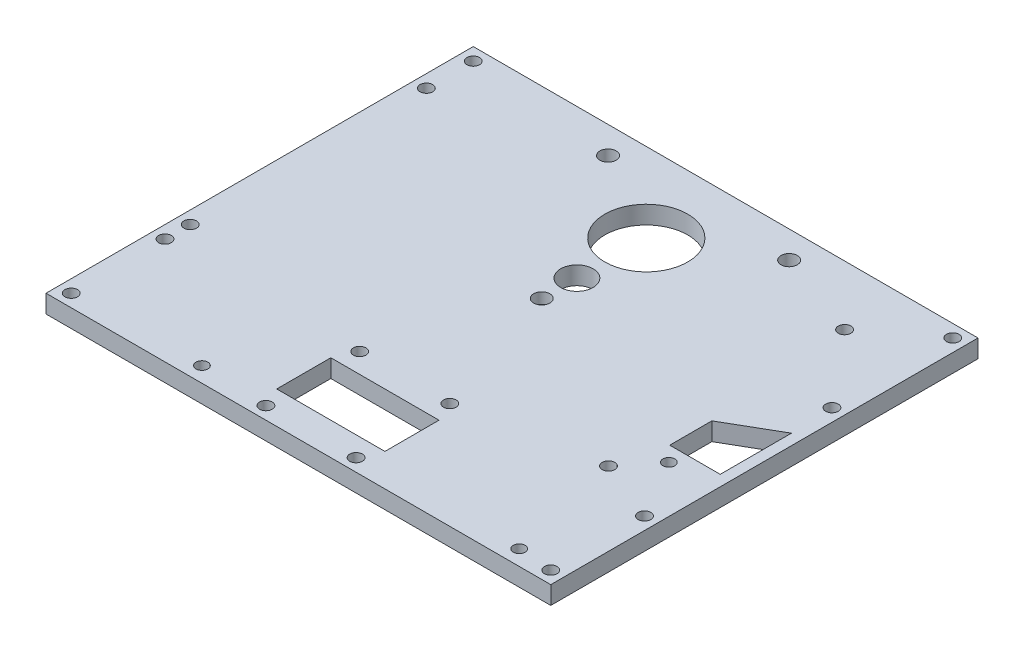
from build123d import *

# Parameters (mm, degrees)
SKETCH_1_W          = 80
SKETCH_1_H          = 180
EXTRUDE_1_DEPTH     = 5
HOLE_WIZARD_2_D     = 4.5
HOLE_WIZARD_3_D     = 23
HOLE_WIZARD_4_D     = 9
SKETCH_12_W         = 80
SKETCH_12_H         = 110
CUT_EXTRUDE_1_DEPTH = 10
SKETCH_13_W         = 80
SKETCH_13_H         = 60
EXTRUDE_2_DEPTH     = 5
SKETCH_14_W         = 30
SKETCH_14_H         = 130
EXTRUDE_3_DEPTH     = 5
SKETCH_15_W         = 140
SKETCH_15_H         = 8
CUT_EXTRUDE_2_DEPTH = 10
SKETCH_16_W         = 140
SKETCH_16_H         = 18
EXTRUDE_4_DEPTH     = 5
HOLE_WIZARD_5_D     = 9
HOLE_WIZARD_5_DEPTH = 2
HOLE_WIZARD_6_D     = 3.5
HOLE_WIZARD_7_D     = 3.5
SKETCH_26_W         = 140
SKETCH_26_H         = 21.5
CUT_EXTRUDE_3_DEPTH = 10
HOLE_WIZARD_8_D     = 3.5
SKETCH_30_W         = 15
SKETCH_30_H         = 15
CUT_EXTRUDE_4_DEPTH = 163.441527942
HOLE_WIZARD_9_D     = 3.5
CUT_EXTRUDE_5_DEPTH = 10
HOLE_WIZARD_10_D    = 3.3


with BuildPart() as part:
    # 草图1 → 凸台-拉伸1 (new body)
    with BuildSketch(Plane(origin=(0, 0, 0), x_dir=(1, 0, 0), z_dir=(0, 1, 0))):
        Rectangle(SKETCH_1_W, SKETCH_1_H)
    extrude(amount=EXTRUDE_1_DEPTH)

    # 孔2 (through all)
    with Locations(Plane(origin=(0, 5, 0), x_dir=(1, 0, 0), z_dir=(0, 1, 0))):
        with Locations((0, -79), (25.11473671, -35.5), (-25.11473671, -35.5)):
            Hole(HOLE_WIZARD_2_D / 2)

    # 孔3 (through all)
    with Locations(Plane(origin=(0, 5, 0), x_dir=(1, 0, 0), z_dir=(0, 1, 0))):
        with Locations((0, -50)):
            Hole(HOLE_WIZARD_3_D / 2)

    # 孔4 (through all)
    with Locations(Plane(origin=(0, 5, 0), x_dir=(1, 0, 0), z_dir=(0, 1, 0))):
        with Locations((0, -69.25)):
            Hole(HOLE_WIZARD_4_D / 2)

    # 草图12 → 切除-拉伸1 (cut)
    with BuildSketch(Plane(origin=(0, 5, 0), x_dir=(1, 0, 0), z_dir=(0, 1, 0))):
        with Locations((0, 35)):
            Rectangle(SKETCH_12_W, SKETCH_12_H)
    extrude(amount=-CUT_EXTRUDE_1_DEPTH, mode=Mode.SUBTRACT)

    # 草图13 → 凸台-拉伸2 (add)
    with BuildSketch(Plane(origin=(0, 5, 0), x_dir=(1, 0, 0), z_dir=(0, 1, 0))):
        with Locations((0, -120)):
            Rectangle(SKETCH_13_W, SKETCH_13_H)
    extrude(amount=-EXTRUDE_2_DEPTH)

    # 草图14 → 凸台-拉伸3 (add)
    with BuildSketch(Plane(origin=(0, 5, 0), x_dir=(1, 0, 0), z_dir=(0, 1, 0))):
        with Locations((-55, -85)):
            Rectangle(SKETCH_14_W, SKETCH_14_H)
        with Locations((55, -85)):
            Rectangle(SKETCH_14_W, SKETCH_14_H)
    extrude(amount=-EXTRUDE_3_DEPTH)

    # 草图15 → 切除-拉伸2 (cut)
    with BuildSketch(Plane(origin=(0, 5, 0), x_dir=(1, 0, 0), z_dir=(0, 1, 0))):
        with Locations((0, -24)):
            Rectangle(SKETCH_15_W, SKETCH_15_H)
    extrude(amount=-CUT_EXTRUDE_2_DEPTH, mode=Mode.SUBTRACT)

    # 草图16 → 凸台-拉伸4 (add)
    with BuildSketch(Plane(origin=(0, 5, 0), x_dir=(1, 0, 0), z_dir=(0, 1, 0))):
        with Locations((0, -159)):
            Rectangle(SKETCH_16_W, SKETCH_16_H)
    extrude(amount=-EXTRUDE_4_DEPTH)

    # 孔5
    with Locations(Plane(origin=(0, 0, 0), x_dir=(-1, 0, 0), z_dir=(0, -1, 0))):
        with Locations((0, -79)):
            Hole(HOLE_WIZARD_5_D / 2, depth=HOLE_WIZARD_5_DEPTH)

    # 孔6 (through all)
    with Locations(Plane(origin=(0, 0, 0), x_dir=(-1, 0, 0), z_dir=(0, -1, 0))):
        with Locations((-49.5, -44.5), (-49.5, -110), (66.5, -110), (66.5, -44.5)):
            Hole(HOLE_WIZARD_6_D / 2)

    # 孔7 (through all)
    with Locations(Plane(origin=(0, 5, 0), x_dir=(1, 0, 0), z_dir=(0, 1, 0))):
        with Locations((-66.5, -117), (-12.5, -117), (-12.5, -143), (-66.5, -143)):
            hole_wizard_7 = Hole(HOLE_WIZARD_7_D / 2)

    # 镜向1: 孔7 across plane
    add(hole_wizard_7.mirror(Plane.ZY), mode=Mode.SUBTRACT)

    # 草图26 → 切除-拉伸3 (cut)
    with BuildSketch(Plane(origin=(0, 5, 0), x_dir=(1, 0, 0), z_dir=(0, 1, 0))):
        with Locations((0, -157.25)):
            Rectangle(SKETCH_26_W, SKETCH_26_H)
    extrude(amount=-CUT_EXTRUDE_3_DEPTH, mode=Mode.SUBTRACT)

    # 孔8 (through all)
    with Locations(Plane(origin=(0, 5, 0), x_dir=(1, 0, 0), z_dir=(0, 1, 0))):
        with Locations((-66.5, -31.5), (66.5, -31.5)):
            Hole(HOLE_WIZARD_8_D / 2)

    # 草图30 → 切除-拉伸4 (cut, through all)
    with BuildSketch(Plane.XZ):
        with Locations((7.5, 130)):
            Rectangle(SKETCH_30_W, SKETCH_30_H)
        with Locations((-7.5, 130)):
            Rectangle(SKETCH_30_W, SKETCH_30_H)
    extrude(amount=-CUT_EXTRUDE_4_DEPTH, mode=Mode.SUBTRACT)

    # 孔9 (through all)
    with Locations(Plane(origin=(0, 0, 0), x_dir=(-1, 0, 0), z_dir=(0, -1, 0))):
        with Locations((-66.5, -65)):
            Hole(HOLE_WIZARD_9_D / 2)

    # 草图37 → 切除-拉伸5 (cut)
    with BuildSketch(Plane(origin=(0, 0, 0), x_dir=(-1, 0, 0), z_dir=(0, -1, 0))):
        Polygon((-67, -76.732050808), (-67, -96.5), (-53, -96.5), (-53, -84.814954576), align=None)
    extrude(amount=-CUT_EXTRUDE_5_DEPTH, mode=Mode.SUBTRACT)

    # 孔10 (through all)
    with Locations(Plane(origin=(0, 0, 0), x_dir=(-1, 0, 0), z_dir=(0, -1, 0))):
        with Locations((-57, -100.75), (-57, -142.25), (31, -142.25)):
            Hole(HOLE_WIZARD_10_D / 2)


solid = part.part
